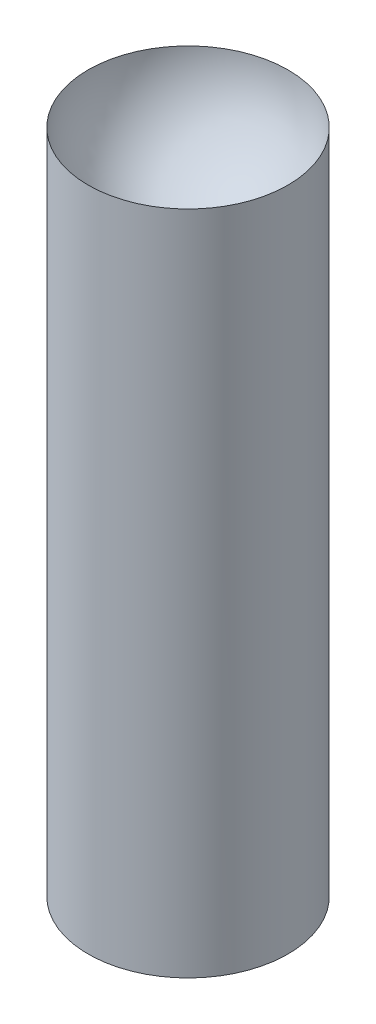
from build123d import *

# Parameters (mm, degrees)
SKETCH1_R           = 11.43
BOSS_EXTRUDE1_DEPTH = 76.2


with BuildPart() as part:
    # Sketch1 → Boss-Extrude1 (new body)
    with BuildSketch(Plane(origin=(0, 0, 0), x_dir=(1, 0, 0), z_dir=(0, 1, 0))):
        with Locations(Location((0, 0, 0), (0, 0, 90))):
            Circle(SKETCH1_R)
    extrude(amount=BOSS_EXTRUDE1_DEPTH)

    # Sketch3 → Cut-Revolve1 (revolve, cut)
    with BuildSketch(Plane(origin=(0, 76.2, 0), x_dir=(1, 0, 0), z_dir=(0, 1, 0))):
        with BuildLine():
            Line((0, 11.43), (0, -11.43))
            ThreePointArc((0, -11.43), (11.43, 0), (0, 11.43))
        make_face()
    revolve(axis=Axis((0, 76.2, -11.43), (0, 0, 1)), mode=Mode.SUBTRACT)


solid = part.part
